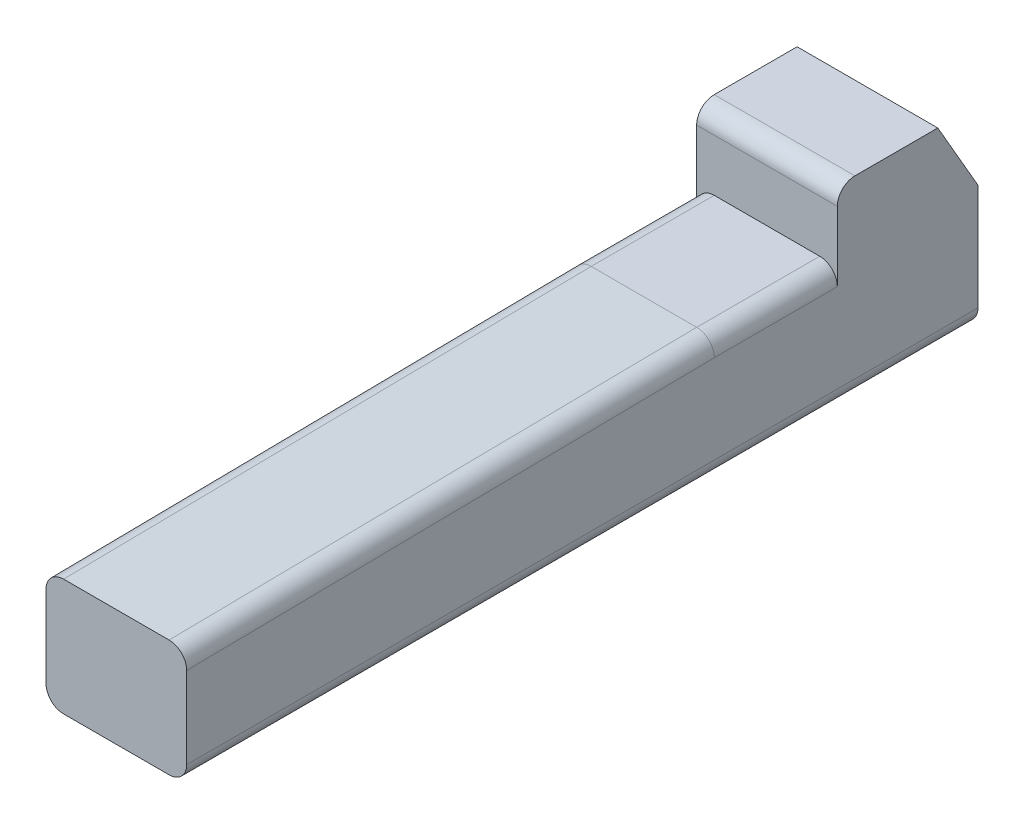
from build123d import *

# Parameters (mm, degrees)
SKETCH1_W               = 8
SKETCH1_H               = 11
BOSS_EXTRUDE1_DEPTH     = 8
SKETCH2_W               = 8
SKETCH2_H               = 7.04
BOSS_EXTRUDE2_DEPTH     = 7
BOSS_EXTRUDE3_DEPTH     = 4
CUT_EXTRUDE_THIN1_DEPTH = 4
FILLET1_R               = 1


with BuildPart() as part:
    # Sketch1 → Boss-Extrude1 (new body)
    with BuildSketch(Plane.XY):
        Rectangle(SKETCH1_W, SKETCH1_H)
    extrude(amount=BOSS_EXTRUDE1_DEPTH)

    # Sketch2 → Boss-Extrude2 (add)
    with BuildSketch(Plane.XY.offset(8)):
        with Locations((0, -1.98)):
            Rectangle(SKETCH2_W, SKETCH2_H)
    extrude(amount=BOSS_EXTRUDE2_DEPTH)

    # Sketch3 → Boss-Extrude3 (add, symmetric)
    with BuildSketch(Plane(origin=(0, 0, 0), x_dir=(0, 0, -1), z_dir=(1, 0, 0))):
        Polygon((-15, 1.54), (-15, -5.5), (-45, -5.5), (-45, 1.14), align=None)
    extrude(amount=BOSS_EXTRUDE3_DEPTH, both=True)

    # Sketch4 → Cut-Extrude-Thin1 (cut, symmetric)
    with BuildSketch(Plane(origin=(0, 0, 0), x_dir=(0, 0, -1), z_dir=(1, 0, 0))):
        Polygon((0, 1.54), (-2.286307066, 5.5), (6.373946972, 10.5), (8.660254038, 6.54), align=None)
    extrude(amount=CUT_EXTRUDE_THIN1_DEPTH, both=True, mode=Mode.SUBTRACT)

    # Fillet1
    fillet1_edges = [part.edges().sort_by_distance(p)[0] for p in [
        (4, 1.54, 11.5),
        (-4, 1.54, 11.5),
        (-4, 1.34, 30),
        (4, 1.34, 30),
        (4, -5.5, 22.5),
        (-4, -5.5, 22.5),
        (0, 5.5, 8),
    ]]
    fillet(fillet1_edges, radius=FILLET1_R)


solid = part.part
